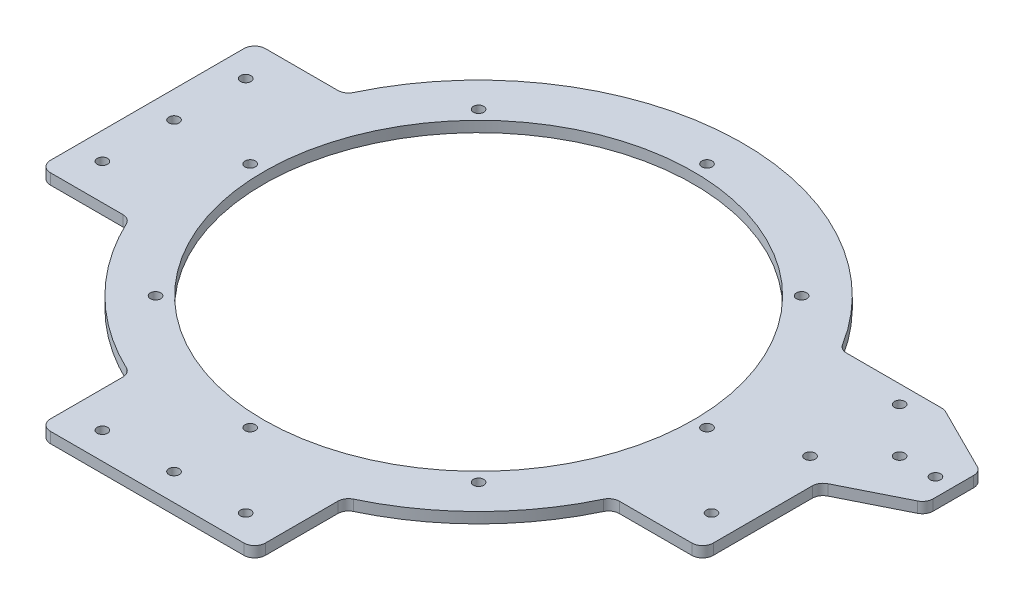
from build123d import *

# Parameters (mm, degrees)
SKETCH_1_R      = 1.45
SKETCH_1_R_2    = 60
EXTRUDE_1_DEPTH = 3
FILLET_2_R      = 3


with BuildPart() as part:
    # 草图1 → 凸台-拉伸1 (new body)
    with BuildSketch(Plane(origin=(0, 0, 0), x_dir=(1, 0, 0), z_dir=(0, 1, 0))):
        with BuildLine():
            Line((-30, -67.372564891), (-30, -92.5))
            Line((-30, -92.5), (30, -92.5))
            Line((30, -92.5), (30, -67.372564891))
            ThreePointArc((30, -67.372564891), (52.149125113, -52.149125113), (67.372564891, -30))
            Line((67.372564891, -30), (92.5, -30))
            Line((92.5, -30), (92.5, 2.5))
            Line((92.5, 2.5), (112.5, 12.5))
            Line((112.5, 12.5), (112.5, 27.5))
            Line((112.5, 27.5), (92.5, 37.5))
            Line((92.5, 37.5), (63.504428979, 37.5))
            ThreePointArc((63.504428979, 37.5), (-4.219374226, 73.629201959), (-67.372564891, 30))
            Line((-67.372564891, 30), (-92.5, 30))
            Line((-92.5, 30), (-92.5, -30))
            Line((-92.5, -30), (-67.372564891, -30))
            ThreePointArc((-67.372564891, -30), (-52.149125113, -52.149125113), (-30, -67.372564891))
        make_face()
        with Locations(Location((-20, -85, 0), (0, 0, 270))):
            Circle(SKETCH_1_R, mode=Mode.SUBTRACT)
        with Locations(Location((0, -85, 0), (0, 0, 270))):
            Circle(SKETCH_1_R, mode=Mode.SUBTRACT)
        with Locations(Location((0, -63.75, 0), (0, 0, 270))):
            Circle(SKETCH_1_R, mode=Mode.SUBTRACT)
        with Locations(Location((-45.078057301, -45.078057301, 0), (0, 0, 270))):
            Circle(SKETCH_1_R, mode=Mode.SUBTRACT)
        with Locations(Location((-85, -20, 0), (0, 0, 270))):
            Circle(SKETCH_1_R, mode=Mode.SUBTRACT)
        with Locations(Location((20, -85, 0), (0, 0, 270))):
            Circle(SKETCH_1_R, mode=Mode.SUBTRACT)
        with Locations(Location((45.078057301, -45.078057301, 0), (0, 0, 270))):
            Circle(SKETCH_1_R, mode=Mode.SUBTRACT)
        with Locations(Location((85, -20, 0), (0, 0, 270))):
            Circle(SKETCH_1_R, mode=Mode.SUBTRACT)
        with Locations(Location((-85, 0, 0), (0, 0, 270))):
            Circle(SKETCH_1_R, mode=Mode.SUBTRACT)
        with Locations(Location((-63.75, 0, 0), (0, 0, 270))):
            Circle(SKETCH_1_R, mode=Mode.SUBTRACT)
        with Locations(Location((-85, 20, 0), (0, 0, 270))):
            Circle(SKETCH_1_R, mode=Mode.SUBTRACT)
        with Locations(Location((0, 0, 0), (0, 0, 270))):
            Circle(SKETCH_1_R_2, mode=Mode.SUBTRACT)
        with Locations(Location((-45.078057301, 45.078057301, 0), (0, 0, 270))):
            Circle(SKETCH_1_R, mode=Mode.SUBTRACT)
        with Locations(Location((0, 63.75, 0), (0, 0, 270))):
            Circle(SKETCH_1_R, mode=Mode.SUBTRACT)
        with Locations(Location((63.75, 0, 0), (0, 0, 270))):
            Circle(SKETCH_1_R, mode=Mode.SUBTRACT)
        with Locations(Location((85, 7.5, 0), (0, 0, 270))):
            Circle(SKETCH_1_R, mode=Mode.SUBTRACT)
        with Locations(Location((45.078057301, 45.078057301, 0), (0, 0, 270))):
            Circle(SKETCH_1_R, mode=Mode.SUBTRACT)
        with Locations(Location((85, 32.5, 0), (0, 0, 270))):
            Circle(SKETCH_1_R, mode=Mode.SUBTRACT)
        with Locations(Location((97.5, 20, 0), (0, 0, 270))):
            Circle(SKETCH_1_R, mode=Mode.SUBTRACT)
        with Locations(Location((107.5, 20, 0), (0, 0, 270))):
            Circle(SKETCH_1_R, mode=Mode.SUBTRACT)
    extrude(amount=EXTRUDE_1_DEPTH)

    # 圆角2
    fillet_2_edges = [part.edges().sort_by_distance(p)[0] for p in [
        (63.504428979, 1.5, -37.5),
        (92.5, 1.5, -37.5),
        (112.5, 1.5, -27.5),
        (112.5, 1.5, -12.5),
        (92.5, 1.5, -2.5),
        (92.5, 1.5, 30),
        (67.372564891, 1.5, 30),
        (30, 1.5, 67.372564891),
        (30, 1.5, 92.5),
        (-30, 1.5, 92.5),
        (-30, 1.5, 67.372564891),
        (-67.372564891, 1.5, 30),
        (-92.5, 1.5, 30),
        (-92.5, 1.5, -30),
        (-67.372564891, 1.5, -30),
    ]]
    fillet(fillet_2_edges, radius=FILLET_2_R)


solid = part.part
